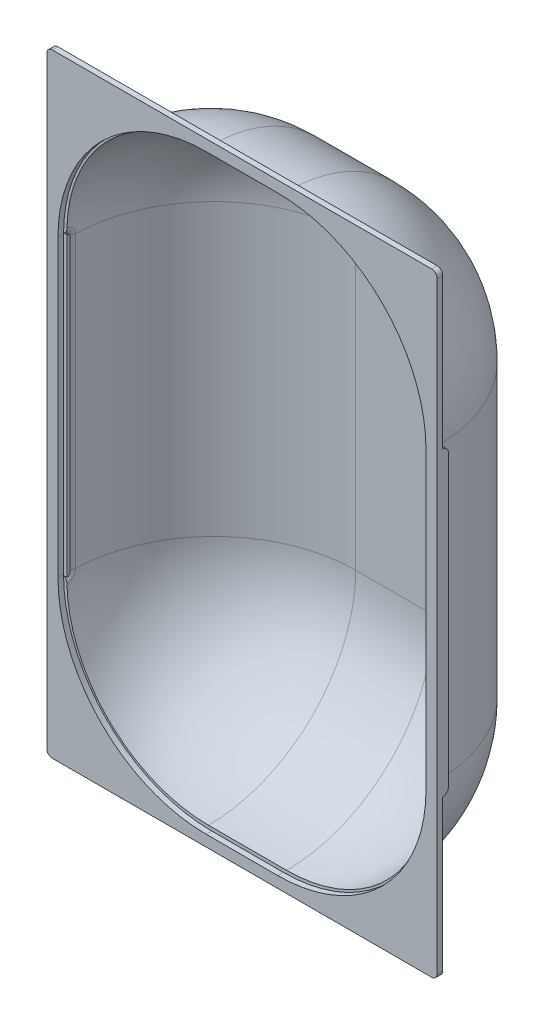
from build123d import *

# Parameters (mm, degrees)
BOSS_EXTRUDE1_DEPTH = 260
REVOLVE1_ANGLE      = 90
REVOLVE2_ANGLE      = 90
SKETCH5_W           = 323.946027299
SKETCH5_H           = 266
CUT_EXTRUDE1_DEPTH  = 5
SKETCH6_W           = 350
SKETCH6_H           = 550
BOSS_EXTRUDE2_DEPTH = 5
FILLET1_R           = 5


with BuildPart() as part:
    # Sketch1 → Boss-Extrude1 (new body)
    with BuildSketch(Plane(origin=(0, 0, 0), x_dir=(1, 0, 0), z_dir=(0, 1, 0))):
        with BuildLine():
            Line((0, 0), (330, 0))
            Line((330, 0), (340, 0))
            Line((340, 0), (340, 5))
            Line((340, 5), (332.966161109, 5))
            ThreePointArc((332.966161109, 5), (330.868901888, 5.854888404), (329.966924392, 7.932330827))
            ThreePointArc((329.966924392, 7.932330827), (290.881232915, 97.954835828), (200, 135))
            Line((200, 135), (130, 135))
            ThreePointArc((130, 135), (39.118767085, 97.954835828), (0.033075608, 7.932330827))
            ThreePointArc((0.033075608, 7.932330827), (-0.868901888, 5.854888404), (-2.966161109, 5))
            Line((-2.966161109, 5), (-10, 5))
            Line((-10, 5), (-10, 0))
            Line((-10, 0), (0, 0))
        make_face()
        with BuildLine():
            Line((0.350463682, 3), (329.649536318, 3))
            ThreePointArc((329.649536318, 3), (327.711734691, 5.103277193), (326.967687675, 7.864661654))
            ThreePointArc((326.967687675, 7.864661654), (288.783973694, 95.809724232), (200, 132))
            Line((200, 132), (130, 132))
            ThreePointArc((130, 132), (41.216026306, 95.809724232), (3.032312325, 7.864661654))
            ThreePointArc((3.032312325, 7.864661654), (2.288265309, 5.103277193), (0.350463682, 3))
        make_face(mode=Mode.SUBTRACT)
    extrude(amount=BOSS_EXTRUDE1_DEPTH)

    # Sketch3 → Revolve1 (revolve)
    with BuildSketch(Plane.XZ):
        with BuildLine():
            Line((0, 0), (330, 0))
            Line((330, 0), (340, 0))
            Line((340, 0), (340, -5))
            Line((340, -5), (332.966161109, -5))
            ThreePointArc((332.966161109, -5), (330.868901888, -5.854888404), (329.966924392, -7.932330827))
            ThreePointArc((329.966924392, -7.932330827), (290.881232915, -97.954835828), (200, -135))
            Line((200, -135), (130, -135))
            ThreePointArc((130, -135), (39.118767085, -97.954835828), (0.033075608, -7.932330827))
            ThreePointArc((0.033075608, -7.932330827), (-0.868901888, -5.854888404), (-2.966161109, -5))
            Line((-2.966161109, -5), (-10, -5))
            Line((-10, -5), (-10, 0))
            Line((-10, 0), (0, 0))
        make_face()
        with BuildLine():
            Line((130, -132), (200, -132))
            ThreePointArc((200, -132), (288.783973694, -95.809724232), (326.967687675, -7.864661654))
            ThreePointArc((326.967687675, -7.864661654), (327.711734691, -5.103277193), (329.649536318, -3))
            Line((329.649536318, -3), (0.350463682, -3))
            ThreePointArc((0.350463682, -3), (2.288265309, -5.103277193), (3.032312325, -7.864661654))
            ThreePointArc((3.032312325, -7.864661654), (41.216026306, -95.809724232), (130, -132))
        make_face(mode=Mode.SUBTRACT)
    revolve(axis=Axis((0, 0, 0), (-1, 0, 0)), revolution_arc=REVOLVE1_ANGLE)

    # Sketch4 → Revolve2 (revolve)
    with BuildSketch(Plane(origin=(0, 260, 0), x_dir=(1, 0, 0), z_dir=(0, 1, 0))):
        with BuildLine():
            Line((0, 0), (330, 0))
            Line((330, 0), (340, 0))
            Line((340, 0), (340, 5))
            Line((340, 5), (332.966161109, 5))
            ThreePointArc((332.966161109, 5), (330.868901888, 5.854888404), (329.966924392, 7.932330827))
            ThreePointArc((329.966924392, 7.932330827), (290.881232915, 97.954835828), (200, 135))
            Line((200, 135), (130, 135))
            ThreePointArc((130, 135), (39.118767085, 97.954835828), (0.033075608, 7.932330827))
            ThreePointArc((0.033075608, 7.932330827), (-0.868901888, 5.854888404), (-2.966161109, 5))
            Line((-2.966161109, 5), (-10, 5))
            Line((-10, 5), (-10, 0))
            Line((-10, 0), (0, 0))
        make_face()
        with BuildLine():
            Line((0.350463682, 3), (329.649536318, 3))
            ThreePointArc((329.649536318, 3), (327.711734691, 5.103277193), (326.967687675, 7.864661654))
            ThreePointArc((326.967687675, 7.864661654), (288.783973694, 95.809724232), (200, 132))
            Line((200, 132), (130, 132))
            ThreePointArc((130, 132), (41.216026306, 95.809724232), (3.032312325, 7.864661654))
            ThreePointArc((3.032312325, 7.864661654), (2.288265309, 5.103277193), (0.350463682, 3))
        make_face(mode=Mode.SUBTRACT)
    revolve(axis=Axis((0, 260, 0), (1, 0, 0)), revolution_arc=REVOLVE2_ANGLE)

    # Sketch5 → Cut-Extrude1 (cut)
    with BuildSketch(Plane.XY):
        with Locations((164.994674026, 130)):
            Rectangle(SKETCH5_W, SKETCH5_H)
    extrude(amount=-CUT_EXTRUDE1_DEPTH, mode=Mode.SUBTRACT)

    # Sketch6 → Boss-Extrude2 (add)
    with BuildSketch(Plane.XY):
        with Locations((165, 130)):
            Rectangle(SKETCH6_W, SKETCH6_H)
        with BuildLine():
            Line((133, -135.00977849), (197, -135.00977849))
            ThreePointArc((197, -135.00977849), (291.045201898, -96.054980388), (330, -2.00977849))
            Line((330, -2.00977849), (330, 262.00977849))
            ThreePointArc((330, 262.00977849), (291.045201898, 356.054980388), (197, 395.00977849))
            Line((197, 395.00977849), (133, 395.00977849))
            ThreePointArc((133, 395.00977849), (38.954798102, 356.054980388), (0, 262.00977849))
            Line((0, 262.00977849), (0, -2.00977849))
            ThreePointArc((0, -2.00977849), (38.954798102, -96.054980388), (133, -135.00977849))
        make_face(mode=Mode.SUBTRACT)
    extrude(amount=BOSS_EXTRUDE2_DEPTH)

    # Fillet1
    fillet1_edges = [part.edges().sort_by_distance(p)[0] for p in [
        (340, -145, 2.5),
        (340, 405, 2.5),
        (-10, 405, 2.5),
        (-10, -145, 2.5),
    ]]
    fillet(fillet1_edges, radius=FILLET1_R)


solid = part.part
